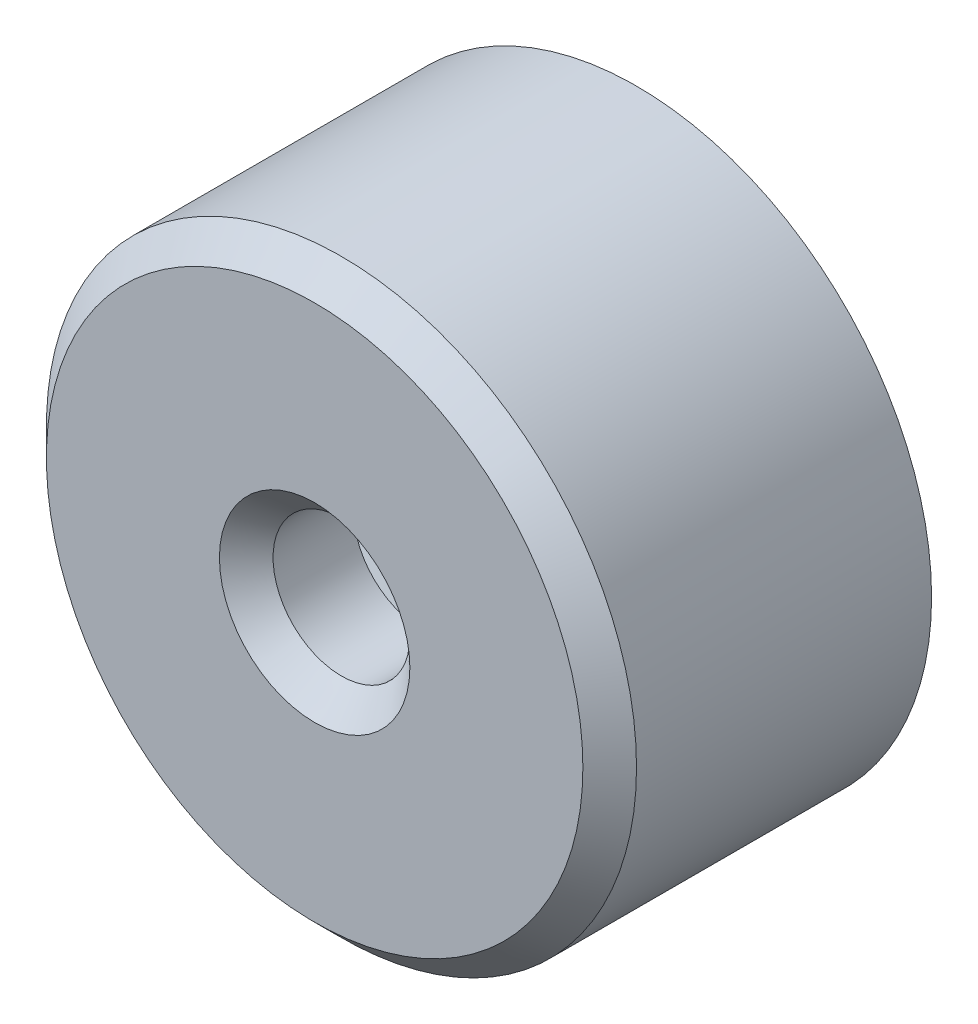
from build123d import *

# Parameters (mm, degrees)
SKETCH1_R           = 11
BOSS_EXTRUDE1_DEPTH = 8
SKETCH2_R           = 11
SKETCH2_R_2         = 2.55
BOSS_EXTRUDE2_DEPTH = 4
CHAMFER1_SIZE       = 1


with BuildPart() as part:
    # Sketch1 → Boss-Extrude1 (new body)
    with BuildSketch(Plane.XY):
        Circle(SKETCH1_R)
        Polygon((4.05, 2.33826859), (0, 4.67653718), (-4.05, 2.33826859), (-4.05, -2.33826859), (0, -4.67653718), (4.05, -2.33826859), align=None, mode=Mode.SUBTRACT)
    extrude(amount=BOSS_EXTRUDE1_DEPTH)

    # Sketch2 → Boss-Extrude2 (add)
    with BuildSketch(Plane.XY.offset(8)):
        Circle(SKETCH2_R)
        Circle(SKETCH2_R_2, mode=Mode.SUBTRACT)
    extrude(amount=BOSS_EXTRUDE2_DEPTH)

    # Chamfer1
    chamfer1_edges = [part.edges().sort_by_distance(p)[0] for p in [
        (-2.025, 3.507402885, 0),
        (-4.05, 0, 0),
        (-2.025, -3.507402885, 0),
        (2.025, -3.507402885, 0),
        (-11, 0, 12),
        (-2.55, 0, 12),
        (4.05, 0, 0),
        (2.025, 3.507402885, 0),
    ]]
    chamfer(chamfer1_edges, length=CHAMFER1_SIZE)


solid = part.part
